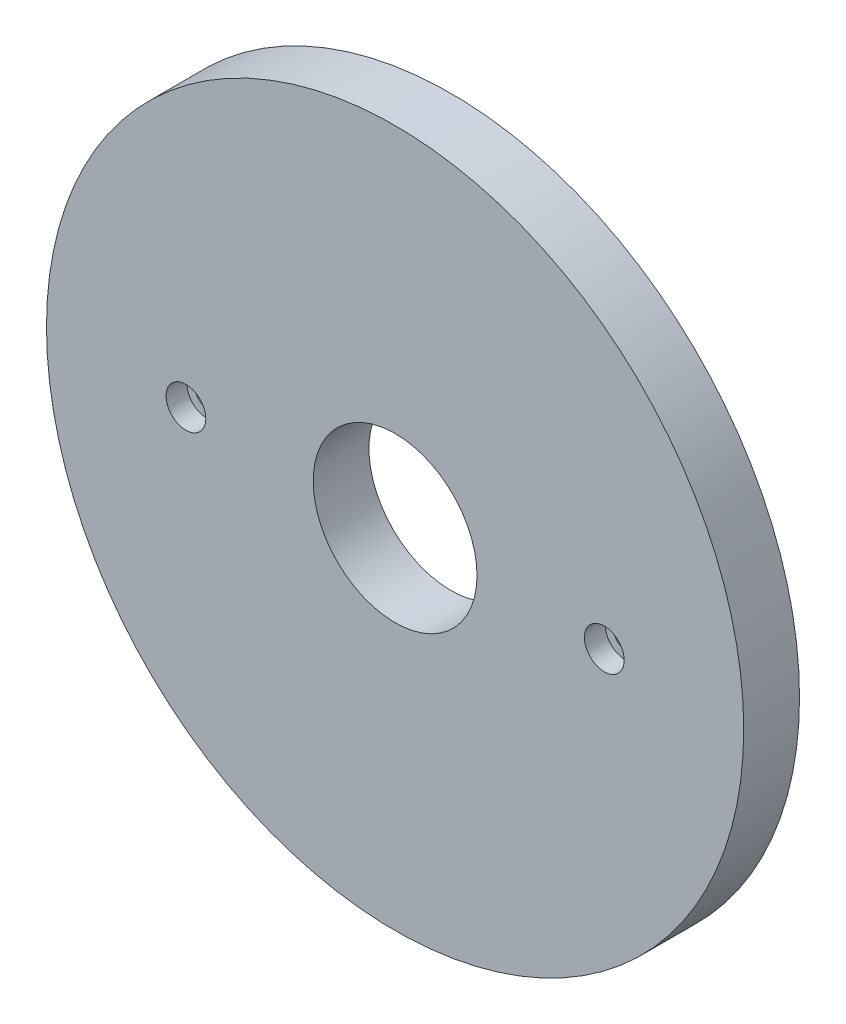
from build123d import *

# Parameters (mm, degrees)
ESQUISSE1_R             = 50
ESQUISSE1_R_2           = 11.75
BOSS_EXTRU_1_DEPTH      = 8
ESQUISSE2_R             = 1.6
ENL_V_MAT_EXTRU_1_DEPTH = 72.161787499
ESQUISSE3_R             = 2.85
ENL_V_MAT_EXTRU_2_DEPTH = 3


with BuildPart() as part:
    # Esquisse1 → Boss.-Extru.1 (new body)
    with BuildSketch(Plane.XY):
        Circle(ESQUISSE1_R)
        Circle(ESQUISSE1_R_2, mode=Mode.SUBTRACT)
    extrude(amount=-BOSS_EXTRU_1_DEPTH)

    # Esquisse2 → Enlèv. mat.-Extru.1 (cut, through all)
    with BuildSketch(Plane.XY):
        with Locations((30, 0)):
            Circle(ESQUISSE2_R)
        with Locations((-30, 0)):
            Circle(ESQUISSE2_R)
    extrude(amount=-ENL_V_MAT_EXTRU_1_DEPTH, mode=Mode.SUBTRACT)

    # Esquisse3 → Enlèv. mat.-Extru.2 (cut)
    with BuildSketch(Plane.XY):
        with Locations((30, 0)):
            Circle(ESQUISSE3_R)
        with Locations((-30, 0)):
            Circle(ESQUISSE3_R)
    extrude(amount=-ENL_V_MAT_EXTRU_2_DEPTH, mode=Mode.SUBTRACT)


solid = part.part
